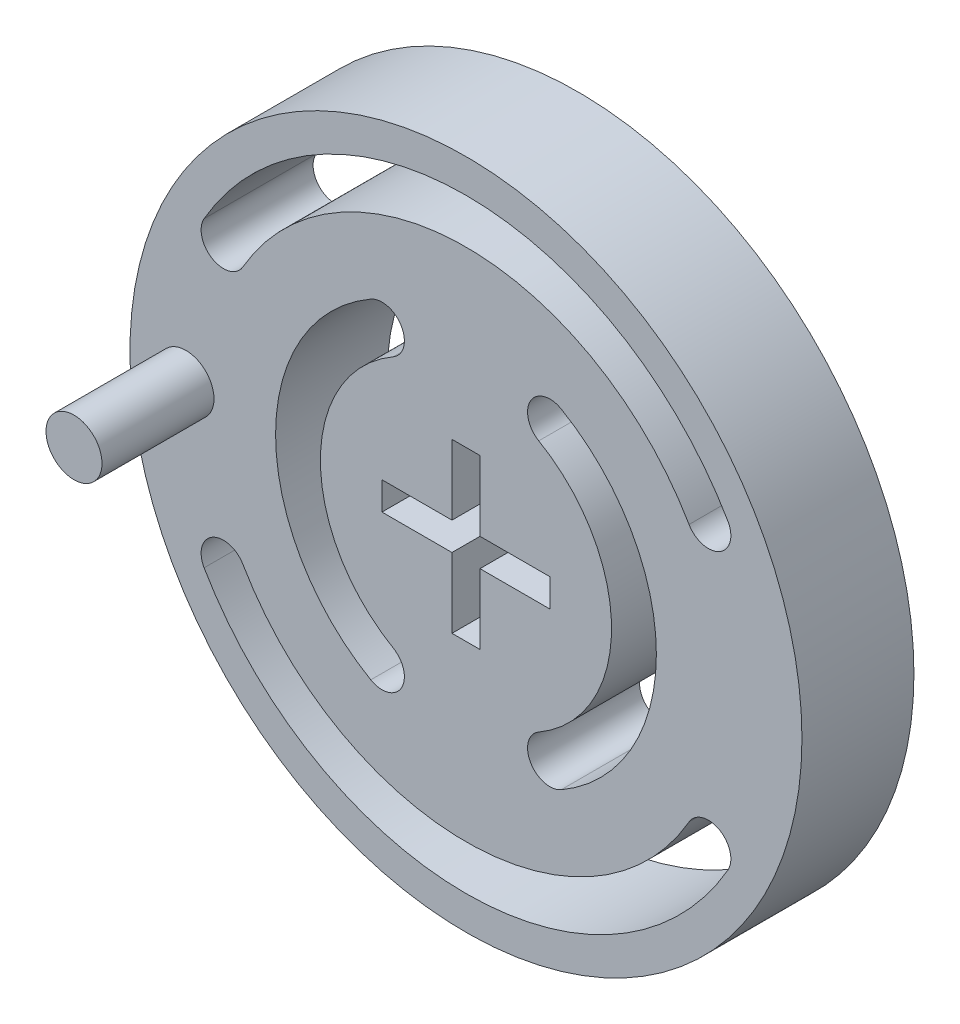
from build123d import *

# Parameters (mm, degrees)
SKETCH_1_R          = 30
EXTRUDE_1_DEPTH     = 10
SKETCH_2_R          = 2.5
EXTRUDE_3_DEPTH     = 10
SKETCH_5_W          = 2.5
SKETCH_5_H          = 6.25
SKETCH_5_W_2        = 6.25
SKETCH_5_H_2        = 2.5
CUT_EXTRUDE_3_DEPTH = 10
CUT_EXTRUDE_4_DEPTH = 20


with BuildPart() as part:
    # 草图1 → 凸台-拉伸1 (new body)
    with BuildSketch(Plane.XY):
        Circle(SKETCH_1_R)
    extrude(amount=EXTRUDE_1_DEPTH)

    # 草图2 → 凸台-拉伸3 (add)
    with BuildSketch(Plane.XY.offset(10)):
        with Locations((-25, 0)):
            Circle(SKETCH_2_R)
    extrude(amount=EXTRUDE_3_DEPTH)

    # 草图5 → 切除-拉伸3 (cut)
    with BuildSketch(Plane.XY.offset(10)):
        with Locations((0, 4.375)):
            Rectangle(SKETCH_5_W, SKETCH_5_H)
        with Locations((-4.375, 0)):
            Rectangle(SKETCH_5_W_2, SKETCH_5_H_2)
        with Locations((4.375, 0)):
            Rectangle(SKETCH_5_W_2, SKETCH_5_H_2)
        with Locations((0, -4.375)):
            Rectangle(SKETCH_5_W, SKETCH_5_H)
        Rectangle(SKETCH_5_W, SKETCH_5_H_2)
    extrude(amount=-CUT_EXTRUDE_3_DEPTH, mode=Mode.SUBTRACT)

    # 草图7 → 切除-拉伸4 (cut)
    with BuildSketch(Plane.XY.offset(10)):
        with BuildLine():
            ThreePointArc((23.382685902, 13.5), (0, 27), (-23.382685902, 13.5))
            ThreePointArc((-23.382685902, 13.5), (-22.650635095, 10.767949192), (-19.918584287, 11.5))
            ThreePointArc((-19.918584287, 11.5), (0, 23), (19.918584287, 11.5))
            ThreePointArc((19.918584287, 11.5), (22.650635095, 10.767949192), (23.382685902, 13.5))
        make_face()
        with BuildLine():
            ThreePointArc((23.382685902, -13.5), (0, -27), (-23.382685902, -13.5))
            ThreePointArc((-23.382685902, -13.5), (-22.650635095, -10.767949192), (-19.918584287, -11.5))
            ThreePointArc((-19.918584287, -11.5), (0, -23), (19.918584287, -11.5))
            ThreePointArc((19.918584287, -11.5), (22.650635095, -10.767949192), (23.382685902, -13.5))
        make_face()
        with BuildLine():
            ThreePointArc((-8.5, 14.722431864), (-17, 0), (-8.5, -14.722431864))
            ThreePointArc((-8.5, -14.722431864), (-5.767949192, -13.990381057), (-6.5, -11.258330249))
            ThreePointArc((-6.5, -11.258330249), (-13, 0), (-6.5, 11.258330249))
            ThreePointArc((-6.5, 11.258330249), (-5.767949192, 13.990381057), (-8.5, 14.722431864))
        make_face()
        with BuildLine():
            ThreePointArc((8.5, 14.722431864), (17, 0), (8.5, -14.722431864))
            ThreePointArc((8.5, -14.722431864), (5.767949192, -13.990381057), (6.5, -11.258330249))
            ThreePointArc((6.5, -11.258330249), (13, 0), (6.5, 11.258330249))
            ThreePointArc((6.5, 11.258330249), (5.767949192, 13.990381057), (8.5, 14.722431864))
        make_face()
    extrude(amount=-CUT_EXTRUDE_4_DEPTH, mode=Mode.SUBTRACT)


solid = part.part
